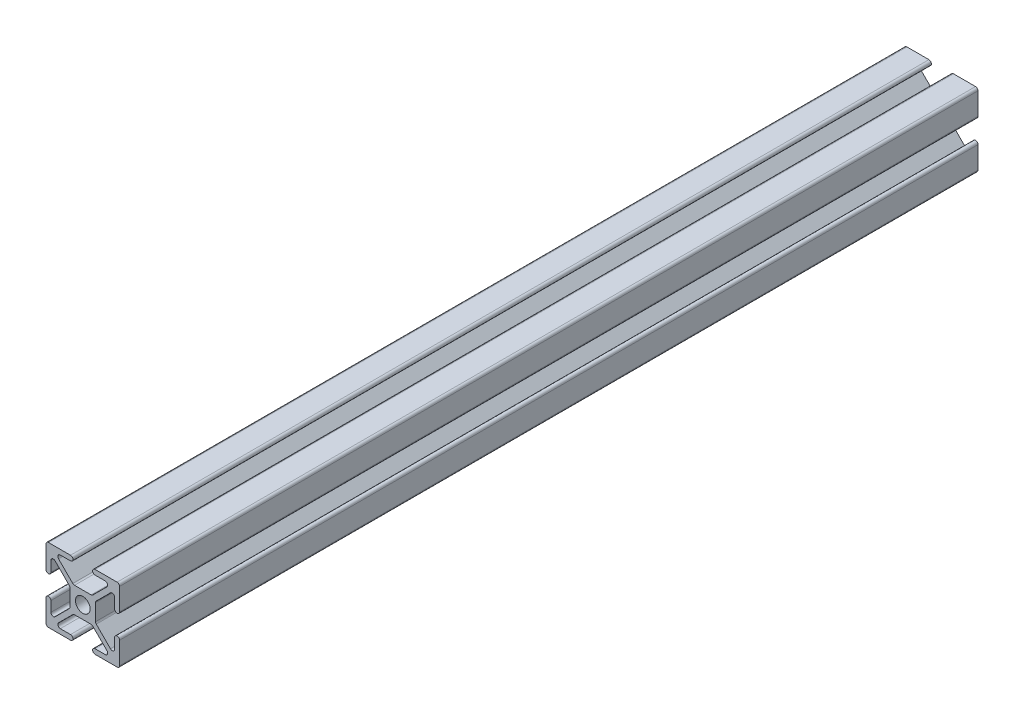
from build123d import *

# Parameters (mm, degrees)
SALIENTE_EXTRUIR1_DEPTH = 350
CROQUIS2_R              = 3
CORTAR_EXTRUIR1_DEPTH   = 351.642267846
CORTAR_EXTRUIR3_DEPTH   = 351.642267846


with BuildPart() as part:
    # Croquis1 → Saliente-Extruir1 (new body)
    with BuildSketch(Plane.XY):
        with BuildLine():
            Line((-14, 15), (14, 15))
            ThreePointArc((14, 15), (14.707106781, 14.707106781), (15, 14))
            Line((15, 14), (15, -14))
            ThreePointArc((15, -14), (14.707106781, -14.707106781), (14, -15))
            Line((14, -15), (-14, -15))
            ThreePointArc((-14, -15), (-14.707106781, -14.707106781), (-15, -14))
            Line((-15, -14), (-15, 14))
            ThreePointArc((-15, 14), (-14.707106781, 14.707106781), (-14, 15))
        make_face()
    extrude(amount=-SALIENTE_EXTRUIR1_DEPTH)

    # Croquis2 → Cortar-Extruir1 (cut, through all)
    with BuildSketch(Plane.XY):
        Circle(CROQUIS2_R)
    extrude(amount=-CORTAR_EXTRUIR1_DEPTH, mode=Mode.SUBTRACT)

    # Croquis3 → Cortar-Extruir3 (cut, through all)
    with BuildSketch(Plane.XY):
        with BuildLine():
            Line((-5.492893219, 4.078679656), (-11.292893219, 9.878679656))
            ThreePointArc((-11.292893219, 9.878679656), (-12.382683432, 10.095452408), (-13, 9.171572875))
            Line((-13, 9.171572875), (-13, 5))
            ThreePointArc((-13, 5), (-14, 4), (-15, 5))
            Line((-15, 5), (-15, -5))
            ThreePointArc((-15, -5), (-14, -4), (-13, -5))
            Line((-13, -5), (-13, -9.171572875))
            ThreePointArc((-13, -9.171572875), (-12.382683432, -10.095452408), (-11.292893219, -9.878679656))
            Line((-11.292893219, -9.878679656), (-5.492893219, -4.078679656))
            ThreePointArc((-5.492893219, -4.078679656), (-5.276120467, -3.754256308), (-5.2, -3.371572875))
            Line((-5.2, -3.371572875), (-5.2, 3.371572875))
            ThreePointArc((-5.2, 3.371572875), (-5.276120467, 3.754256308), (-5.492893219, 4.078679656))
        make_face()
        with BuildLine():
            ThreePointArc((-9.171572875, 13), (-10.095452408, 12.382683432), (-9.878679656, 11.292893219))
            Line((-9.878679656, 11.292893219), (-4.078679656, 5.492893219))
            ThreePointArc((-4.078679656, 5.492893219), (-3.754256308, 5.276120467), (-3.371572875, 5.2))
            Line((-3.371572875, 5.2), (3.371572875, 5.2))
            ThreePointArc((3.371572875, 5.2), (3.754256308, 5.276120467), (4.078679656, 5.492893219))
            Line((4.078679656, 5.492893219), (9.878679656, 11.292893219))
            ThreePointArc((9.878679656, 11.292893219), (10.095452408, 12.382683432), (9.171572875, 13))
            Line((9.171572875, 13), (5, 13))
            ThreePointArc((5, 13), (4, 14), (5, 15))
            Line((5, 15), (-5, 15))
            ThreePointArc((-5, 15), (-4.292893219, 14.707106781), (-4, 14))
            ThreePointArc((-4, 14), (-4.292893219, 13.292893219), (-5, 13))
            Line((-5, 13), (-9.171572875, 13))
        make_face()
        with BuildLine():
            Line((9.878679656, -11.292893219), (4.078679656, -5.492893219))
            ThreePointArc((4.078679656, -5.492893219), (3.754256308, -5.276120467), (3.371572875, -5.2))
            Line((3.371572875, -5.2), (-3.371572875, -5.2))
            ThreePointArc((-3.371572875, -5.2), (-3.754256308, -5.276120467), (-4.078679656, -5.492893219))
            Line((-4.078679656, -5.492893219), (-9.878679656, -11.292893219))
            ThreePointArc((-9.878679656, -11.292893219), (-10.095452408, -12.382683432), (-9.171572875, -13))
            Line((-9.171572875, -13), (-5, -13))
            ThreePointArc((-5, -13), (-4.292893219, -13.292893219), (-4, -14))
            ThreePointArc((-4, -14), (-4.292893219, -14.707106781), (-5, -15))
            Line((-5, -15), (5, -15))
            ThreePointArc((5, -15), (4, -14), (5, -13))
            Line((5, -13), (9.171572875, -13))
            ThreePointArc((9.171572875, -13), (10.095452408, -12.382683432), (9.878679656, -11.292893219))
        make_face()
        with BuildLine():
            ThreePointArc((13, 9.171572875), (12.382683432, 10.095452408), (11.292893219, 9.878679656))
            Line((11.292893219, 9.878679656), (5.492893219, 4.078679656))
            ThreePointArc((5.492893219, 4.078679656), (5.276120467, 3.754256308), (5.2, 3.371572875))
            Line((5.2, 3.371572875), (5.2, -3.371572875))
            ThreePointArc((5.2, -3.371572875), (5.276120467, -3.754256308), (5.492893219, -4.078679656))
            Line((5.492893219, -4.078679656), (11.292893219, -9.878679656))
            ThreePointArc((11.292893219, -9.878679656), (12.382683432, -10.095452408), (13, -9.171572875))
            Line((13, -9.171572875), (13, -5))
            ThreePointArc((13, -5), (14, -4), (15, -5))
            Line((15, -5), (15, 5))
            ThreePointArc((15, 5), (14, 4), (13, 5))
            Line((13, 5), (13, 9.171572875))
        make_face()
    extrude(amount=-CORTAR_EXTRUIR3_DEPTH, mode=Mode.SUBTRACT)


solid = part.part
